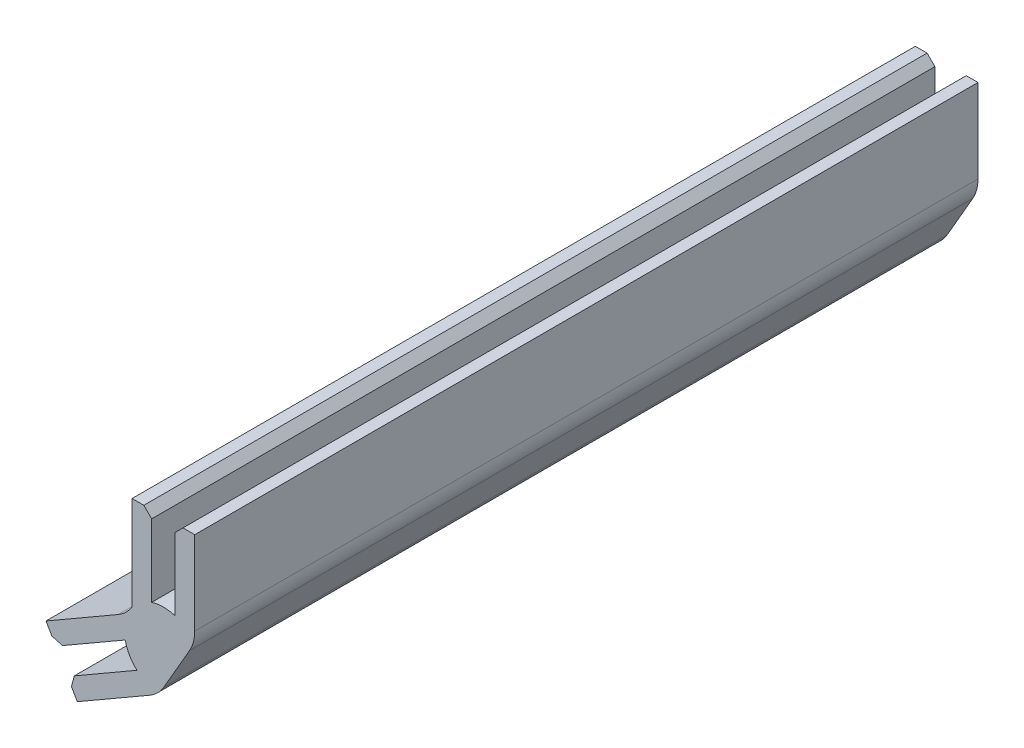
from build123d import *

# Parameters (mm, degrees)
EXTRUDE_1_DEPTH     = 100
CUT_EXTRUDE_2_DEPTH = 103.22383051
FILLET_2_R          = 5
CHAMFER_1_SIZE      = 1


with BuildPart() as part:
    # 草图2 → 凸台-拉伸1 (new body)
    with BuildSketch(Plane.XY):
        with BuildLine():
            Line((1.5, 4.769696007), (1.5, 15))
            Line((1.5, 15), (4, 15))
            Line((4, 15), (4, 3))
            ThreePointArc((4, 3), (4.330127019, -2.5), (-0.598076211, -4.964101615))
            Line((-0.598076211, -4.964101615), (-10.990381057, -10.964101615))
            Line((-10.990381057, -10.964101615), (-12.240381057, -8.799038106))
            Line((-12.240381057, -8.799038106), (-3.38067791, -3.683886109))
            ThreePointArc((-3.38067791, -3.683886109), (-4.330127019, -2.5), (-4.88067791, -1.085809898))
            Line((-4.88067791, -1.085809898), (-13.740381057, -6.200961894))
            Line((-13.740381057, -6.200961894), (-14.990381057, -4.035898385))
            Line((-14.990381057, -4.035898385), (-4.598076211, 1.964101615))
            ThreePointArc((-4.598076211, 1.964101615), (-4.330127019, 2.5), (-4, 3))
            Line((-4, 3), (-4, 15))
            Line((-4, 15), (-1.5, 15))
            Line((-1.5, 15), (-1.5, 4.769696007))
            ThreePointArc((-1.5, 4.769696007), (0, 5), (1.5, 4.769696007))
        make_face()
    extrude(amount=EXTRUDE_1_DEPTH)

    # 草图5 → 切除-拉伸2 (cut, through all)
    with BuildSketch(Plane.XY.offset(100)):
        with BuildLine():
            Line((4, 3), (-0.598076211, -4.964101615))
            ThreePointArc((-0.598076211, -4.964101615), (4.330127019, -2.5), (4, 3))
        make_face()
    extrude(amount=-CUT_EXTRUDE_2_DEPTH, mode=Mode.SUBTRACT)

    # 圆角2
    fillet_2_edges = [part.edges().sort_by_distance(p)[0] for p in [
        (4, 3, 50),
        (-0.598076211, -4.964101615, 50),
        (-4.598076211, 1.964101615, 50),
    ]]
    fillet(fillet_2_edges, radius=FILLET_2_R)

    # 倒角1
    chamfer_1_edges = [part.edges().sort_by_distance(p)[0] for p in [
        (-1.5, 15, 50),
        (1.5, 15, 50),
        (-12.240381057, -8.799038106, 50),
        (-13.740381057, -6.200961894, 50),
    ]]
    chamfer(chamfer_1_edges, length=CHAMFER_1_SIZE)


solid = part.part
